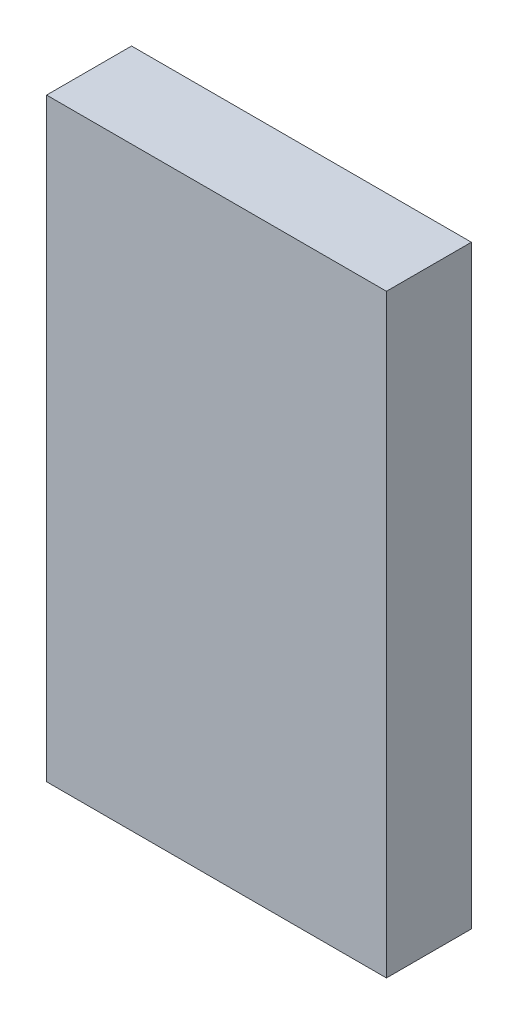
from build123d import *

# Parameters (mm, degrees)
SKETCH1_W           = 25.4
SKETCH1_H           = 44.45
BOSS_EXTRUDE1_DEPTH = 6.35


with BuildPart() as part:
    # Sketch1 → Boss-Extrude1 (new body)
    with BuildSketch(Plane.XY):
        Rectangle(SKETCH1_W, SKETCH1_H)
    extrude(amount=BOSS_EXTRUDE1_DEPTH)


solid = part.part
